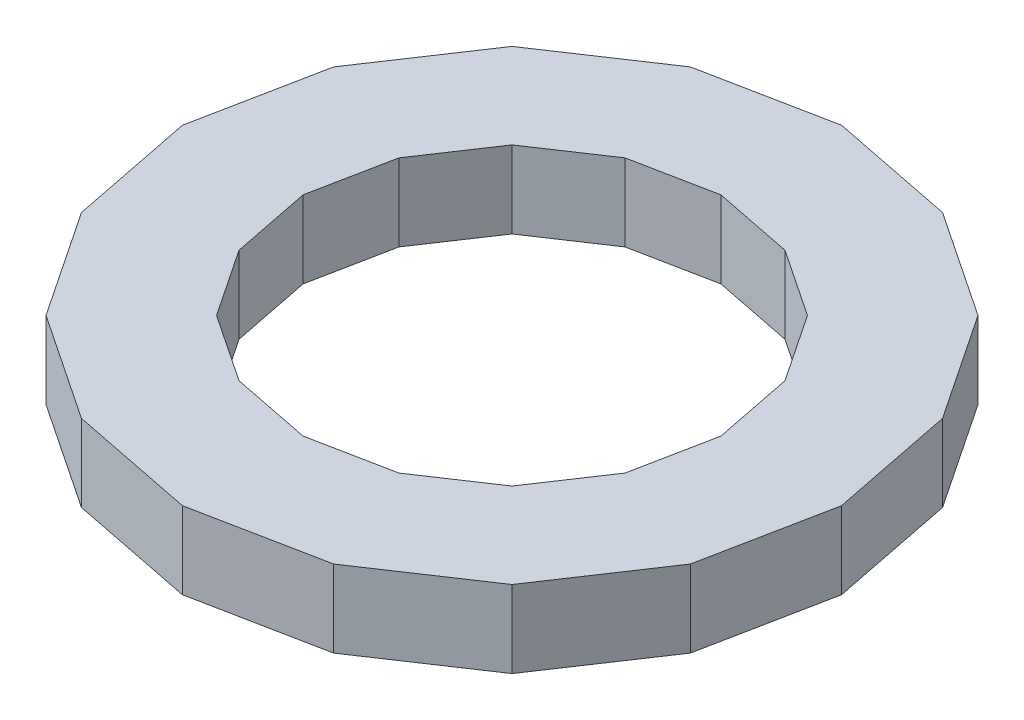
from build123d import *

# Parameters (mm, degrees)
BOSS_EXTRUDE2_DEPTH = 19.05


with BuildPart() as part:
    # Sketch2 → Boss-Extrude2 (new body)
    with BuildSketch(Plane(origin=(0, 0, 0), x_dir=(1, 0, 0), z_dir=(0, 1, 0))):
        Polygon((-81.372565466, 0), (-75.178447742, -31.139932653), (-57.539092843, -57.539092843), (-31.139932653, -75.178447742), (0, -81.372565466), (31.139932653, -75.178447742), (57.539092843, -57.539092843), (75.178447742, -31.139932653), (81.372565466, 0), (75.178447742, 31.139932653), (57.539092843, 57.539092843), (31.139932653, 75.178447742), (0, 81.372565466), (-31.139932653, 75.178447742), (-57.539092843, 57.539092843), (-75.178447742, 31.139932653), align=None)
        Polygon((-51.590307735, 0), (-47.663229392, -19.742756041), (-36.479856443, -36.479856443), (-19.742756041, -47.663229392), (0, -51.590307735), (19.742756041, -47.663229392), (36.479856443, -36.479856443), (47.663229392, -19.742756041), (51.590307735, 0), (47.663229392, 19.742756041), (36.479856443, 36.479856443), (19.742756041, 47.663229392), (0, 51.590307735), (-19.742756041, 47.663229392), (-36.479856443, 36.479856443), (-47.663229392, 19.742756041), align=None, mode=Mode.SUBTRACT)
    extrude(amount=BOSS_EXTRUDE2_DEPTH)


solid = part.part
